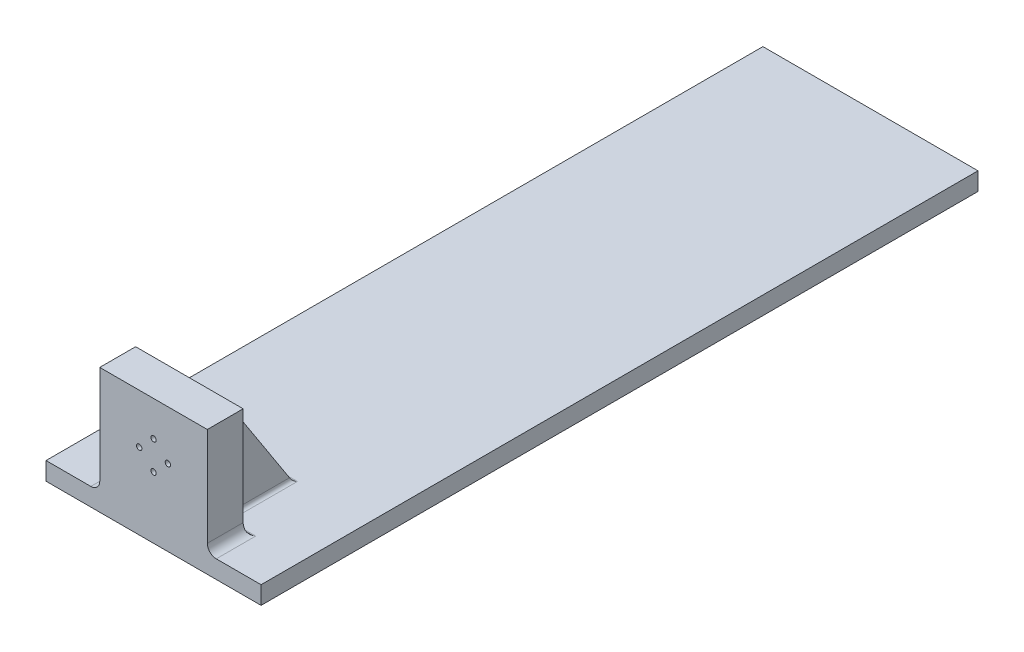
from build123d import *

# Parameters (mm, degrees)
SKETCH2_W           = 120
SKETCH2_H           = 400
THICKEN1_T1         = 10
SKETCH3_W           = 60
SKETCH3_H           = 20
BOSS_EXTRUDE1_DEPTH = 60
FILLET3_R           = 5
SKETCH5_R           = 1.5
CUT_EXTRUDE4_DEPTH  = 31
RIB1_REACH          = 226.778
SKETCH8_WALL_W      = 523.072195762
SKETCH8_WALL_H      = 6.5
FILLET4_R           = 2


with BuildPart() as body_1:
    # Sketch2 → Surface-Plane1: a flat surface bounded by the sketch
    with BuildSketch(Plane(origin=(0, 0, 0), x_dir=(1, 0, 0), z_dir=(0, 1, 0)), mode=Mode.PRIVATE) as surface_plane1_1_region:
        Rectangle(SKETCH2_W, SKETCH2_H)
    surface_plane1_1 = surface_plane1_1_region.sketch.faces()[0]
    add(Solid.thicken(surface_plane1_1, THICKEN1_T1))

    # Sketch3 → Boss-Extrude1 (add)
    with BuildSketch(Plane(origin=(0, 10, 0), x_dir=(1, 0, 0), z_dir=(0, 1, 0))):
        with Locations((0, -190)):
            Rectangle(SKETCH3_W, SKETCH3_H)
    extrude(amount=BOSS_EXTRUDE1_DEPTH)

    # Fillet3
    fillet3_edges = [body_1.edges().sort_by_distance(p)[0] for p in [
        (30, 10, 190),
        (-30, 10, 190),
    ]]
    fillet(fillet3_edges, radius=FILLET3_R)

    # Sketch5 → Cut-Extrude4 (cut)
    with BuildSketch(Plane.XY.offset(200)):
        with Locations((0, 50.5)):
            Circle(SKETCH5_R)
        with Locations((-8, 42.5)):
            Circle(SKETCH5_R)
        with Locations((0, 34.5)):
            Circle(SKETCH5_R)
        with Locations((8, 42.5)):
            Circle(SKETCH5_R)
    extrude(amount=-CUT_EXTRUDE4_DEPTH, mode=Mode.SUBTRACT)

    # Sketch8 wall → Rib1 (add, up to next)
    with BuildSketch(Plane(origin=(15, 40, 160.540675435), x_dir=(0, -0.838963009324, -0.544188449882), z_dir=(0, 0.544188449882, -0.838963009324)), mode=Mode.PRIVATE) as rib1_sk1:
        Rectangle(SKETCH8_WALL_W, SKETCH8_WALL_H)
    rib1_tool1 = extrude(rib1_sk1.sketch, amount=-RIB1_REACH, mode=Mode.PRIVATE) - body_1.part
    rib1 = rib1_tool1.solids().sort_by_distance((15, 40, 160.540675435))[0]
    add(rib1)

    # Mirror1: Rib1 across plane
    add(rib1.mirror(Plane(origin=(0, 0, 0), x_dir=(0, 0, 1), z_dir=(1, 0, 0))))

    # Fillet4
    fillet4_edges = [body_1.edges().sort_by_distance(p)[0] for p in [
        (-18.25, 10, 160.540675435),
        (-15, 10, 141.08135087),
        (-11.75, 10, 160.540675435),
        (0, 10, 180),
        (11.75, 10, 160.540675435),
        (15, 10, 141.08135087),
        (18.25, 10, 160.540675435),
        (26.625, 10, 180),
        (-18.25, 40, 180),
        (-11.75, 40, 180),
        (11.75, 40, 180),
        (18.25, 40, 180),
    ]]
    fillet(fillet4_edges, radius=FILLET4_R)


solid = body_1.part
